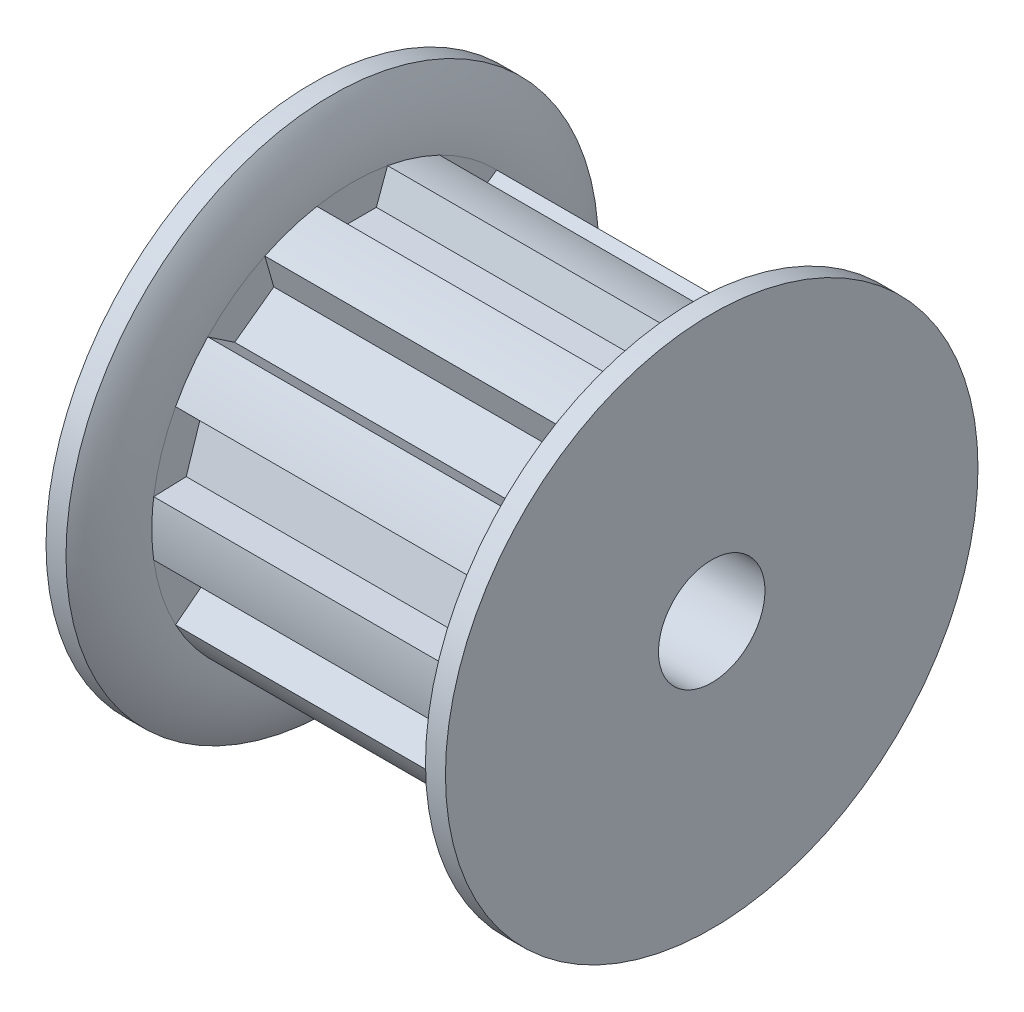
from build123d import *

# Parameters (mm, degrees)
CUT_EXTRUDE1_START = -3
CUT_EXTRUDE1_DEPTH = 12
CIRPATTERN1_COUNT  = 10
SKETCH6_R          = 4
CUT_EXTRUDE2_DEPTH = 6


with BuildPart() as part:
    # Sketch1 → Revolve1 (revolve)
    with BuildSketch(Plane.XY, mode=Mode.PRIVATE) as revolve1_sk:
        with BuildLine():
            Line((-10.5, 2), (10.5, 2))
            Line((10.5, 2), (10.5, 10))
            Line((10.5, 10), (9.75, 10))
            ThreePointArc((9.75, 10), (9.191617437, 8.818070474), (9, 7.525))
            Line((9, 7.525), (-3, 7.525))
            ThreePointArc((-3, 7.525), (-3.191617437, 8.818070474), (-3.75, 10))
            Line((-3.75, 10), (-4.5, 10))
            Line((-4.5, 10), (-4.5, 4))
            Line((-4.5, 4), (-10.5, 4))
            Line((-10.5, 4), (-10.5, 2))
        make_face()
    revolve(revolve1_sk.sketch.rotate(Axis((-10.5, 0, 0), (1, 0, 0)), 90), axis=Axis((-10.5, 0, 0), (1, 0, 0)))

    # Sketch3 → Cut-Extrude1 (cut)
    with BuildSketch(Plane(origin=(0, 0, 0), x_dir=(0, 0, -1), z_dir=(1, 0, 0)).offset(CUT_EXTRUDE1_START)):
        with BuildLine():
            Line((-1.325, 7.407428704), (-0.907223869, 6.259598218))
            Line((-0.907223869, 6.259598218), (0.907223869, 6.259598218))
            Line((0.907223869, 6.259598218), (1.325, 7.407428704))
            ThreePointArc((1.325, 7.407428704), (0, 7.525), (-1.325, 7.407428704))
        make_face()
    cut_extrude1 = extrude(amount=CUT_EXTRUDE1_DEPTH, mode=Mode.SUBTRACT)

    # CirPattern1: Cut-Extrude1 ×10 about axis
    cirpattern1_axis = Axis((0, 0, 0), (1, 0, 0))
    for i in range(1, CIRPATTERN1_COUNT):
        add(cut_extrude1.rotate(cirpattern1_axis, i * 360 / CIRPATTERN1_COUNT), mode=Mode.SUBTRACT)

    # Sketch6 → Cut-Extrude2 (cut)
    with BuildSketch(Plane.ZY.offset(10.5)):
        Circle(SKETCH6_R)
    extrude(amount=-CUT_EXTRUDE2_DEPTH, mode=Mode.SUBTRACT)


solid = part.part
